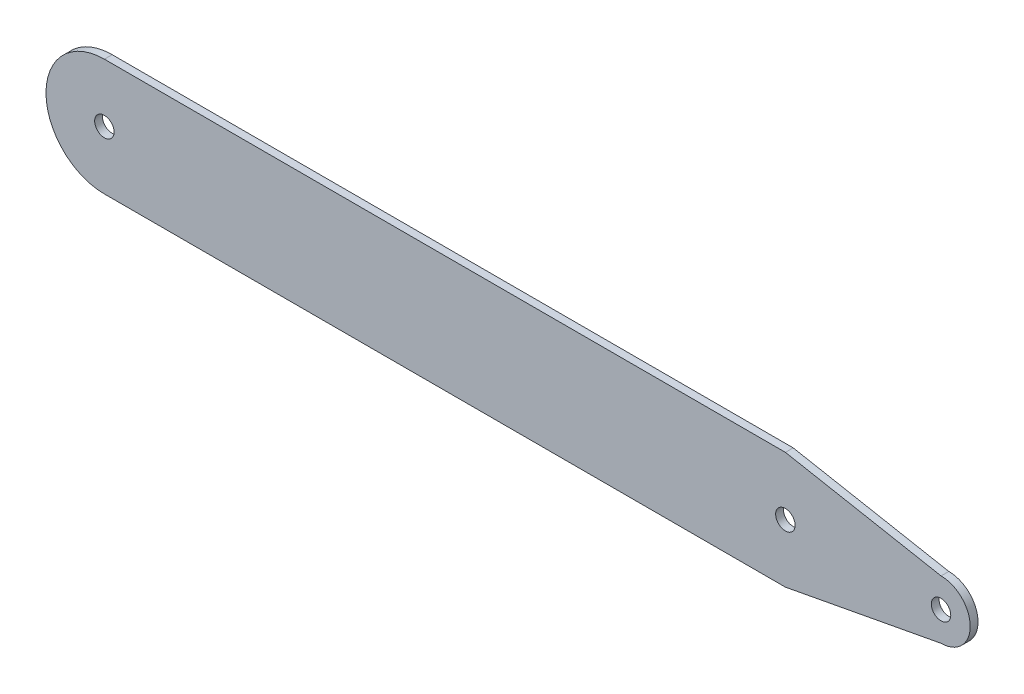
from build123d import *

# Parameters (mm, degrees)
SKETCH_1_R      = 5
EXTRUDE_1_DEPTH = 4


with BuildPart() as part:
    # 草图1 → 凸台-拉伸1 (new body)
    with BuildSketch(Plane.XY):
        with BuildLine():
            Line((428.542857143, -15.145714286), (348.542857143, -30.145714286))
            Line((348.542857143, -30.145714286), (-1.457142857, -30.145714286))
            ThreePointArc((-1.457142857, -30.145714286), (-31.457142857, -0.145714286), (-1.457142857, 29.854285714))
            Line((-1.457142857, 29.854285714), (348.542857143, 29.854285714))
            Line((348.542857143, 29.854285714), (428.542857143, 14.854285714))
            ThreePointArc((428.542857143, 14.854285714), (443.542857143, -0.145714286), (428.542857143, -15.145714286))
        make_face()
        with Locations((428.542857143, -0.145714286)):
            Circle(SKETCH_1_R, mode=Mode.SUBTRACT)
        with Locations((-1.457142857, -0.145714286)):
            Circle(SKETCH_1_R, mode=Mode.SUBTRACT)
        with Locations((348.542857143, -0.145714286)):
            Circle(SKETCH_1_R, mode=Mode.SUBTRACT)
    extrude(amount=EXTRUDE_1_DEPTH)


solid = part.part
